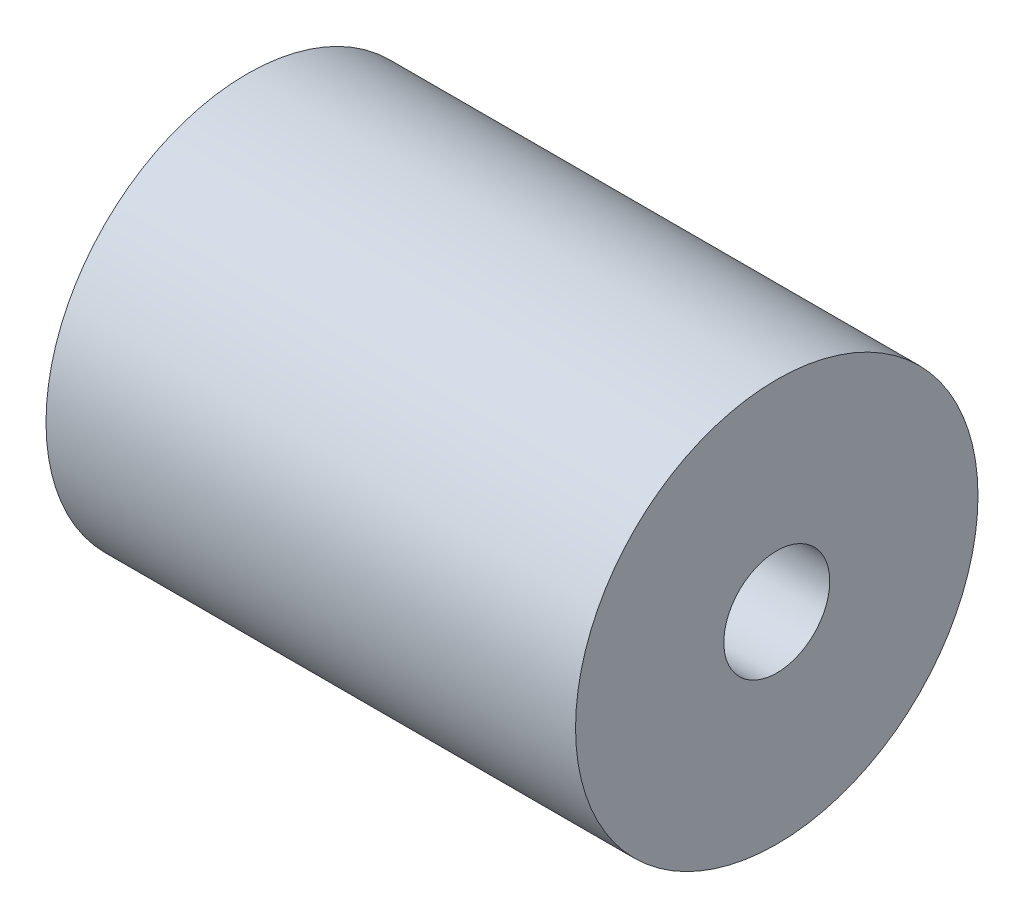
from build123d import *

# Parameters (mm, degrees)
SKETCH_1_R          = 9.5
EXTRUDE_1_DEPTH     = 25
SKETCH_2_R          = 4
CUT_EXTRUDE_1_DEPTH = 18
SKETCH_3_R          = 2.5
CUT_EXTRUDE_2_DEPTH = 18


with BuildPart() as part:
    # 草图1 → 凸台-拉伸1 (new body)
    with BuildSketch(Plane(origin=(0, 0, 0), x_dir=(0, 0, -1), z_dir=(1, 0, 0))):
        with Locations((-30.516757785, 0)):
            Circle(SKETCH_1_R)
    extrude(amount=EXTRUDE_1_DEPTH)

    # 草图2 → 切除-拉伸1 (cut)
    with BuildSketch(Plane.ZY):
        with Locations((30.516757785, 0)):
            Circle(SKETCH_2_R)
    extrude(amount=-CUT_EXTRUDE_1_DEPTH, mode=Mode.SUBTRACT)

    # 草图3 → 切除-拉伸2 (cut)
    with BuildSketch(Plane(origin=(25, 0, 0), x_dir=(0, 0, -1), z_dir=(1, 0, 0))):
        with Locations((-30.516757785, 0)):
            Circle(SKETCH_3_R)
    extrude(amount=-CUT_EXTRUDE_2_DEPTH, mode=Mode.SUBTRACT)


solid = part.part
